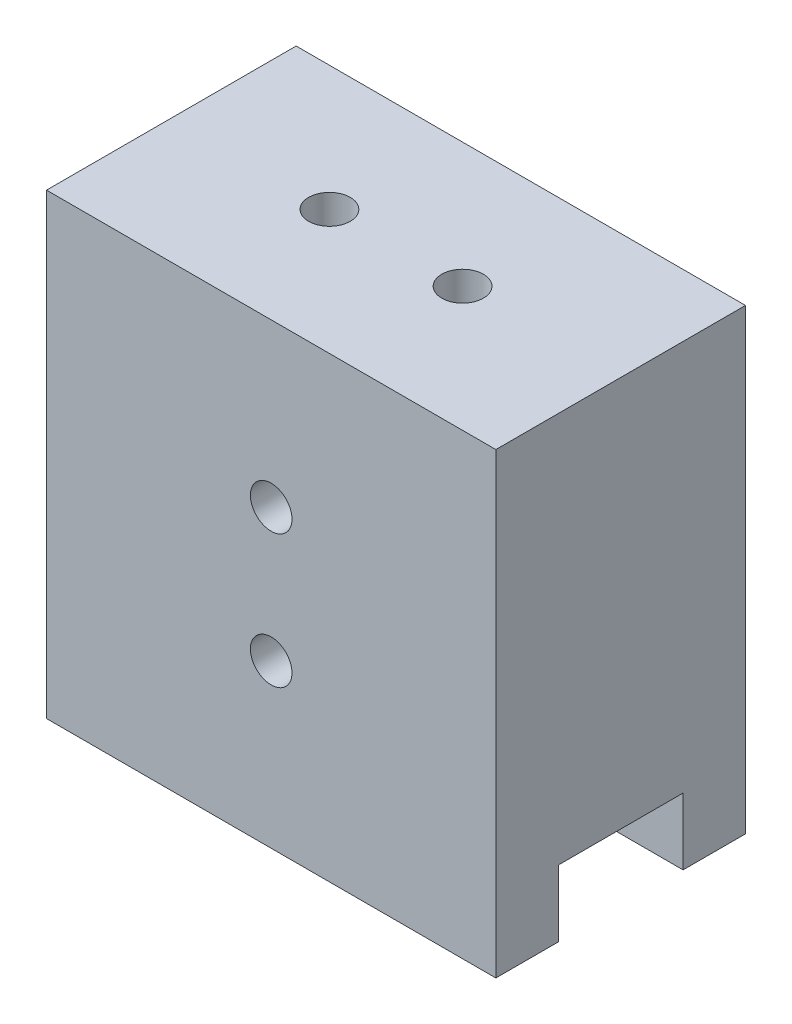
from build123d import *

# Parameters (mm, degrees)
SKETCH1_W           = 54
SKETCH1_H           = 55
BOSS_EXTRUDE1_DEPTH = 30
SKETCH2_W           = 54
SKETCH2_H           = 15
CUT_EXTRUDE1_DEPTH  = 8
SKETCH3_R           = 2.5
CUT_EXTRUDE2_DEPTH  = 10
SKETCH4_R           = 2.5
CUT_EXTRUDE3_DEPTH  = 10


with BuildPart() as part:
    # Sketch1 → Boss-Extrude1 (new body)
    with BuildSketch(Plane.XY):
        with Locations((27, 27.5)):
            Rectangle(SKETCH1_W, SKETCH1_H)
    extrude(amount=BOSS_EXTRUDE1_DEPTH)

    # Sketch2 → Cut-Extrude1 (cut)
    with BuildSketch(Plane.XZ):
        with Locations((27, 15)):
            Rectangle(SKETCH2_W, SKETCH2_H)
    extrude(amount=-CUT_EXTRUDE1_DEPTH, mode=Mode.SUBTRACT)

    # Sketch3 → Cut-Extrude2 (cut)
    with BuildSketch(Plane(origin=(0, 55, 0), x_dir=(1, 0, 0), z_dir=(0, 1, 0))):
        with Locations(Location((19, -15, 0), (0, 0, 270))):
            Circle(SKETCH3_R)
        with Locations(Location((35, -15, 0), (0, 0, 270))):
            Circle(SKETCH3_R)
    extrude(amount=-CUT_EXTRUDE2_DEPTH, mode=Mode.SUBTRACT)

    # Sketch4 → Cut-Extrude3 (cut)
    with BuildSketch(Plane.XY.offset(30)):
        with Locations((27, 35.5)):
            Circle(SKETCH4_R)
        with Locations((27, 19.5)):
            Circle(SKETCH4_R)
    extrude(amount=-CUT_EXTRUDE3_DEPTH, mode=Mode.SUBTRACT)


solid = part.part
